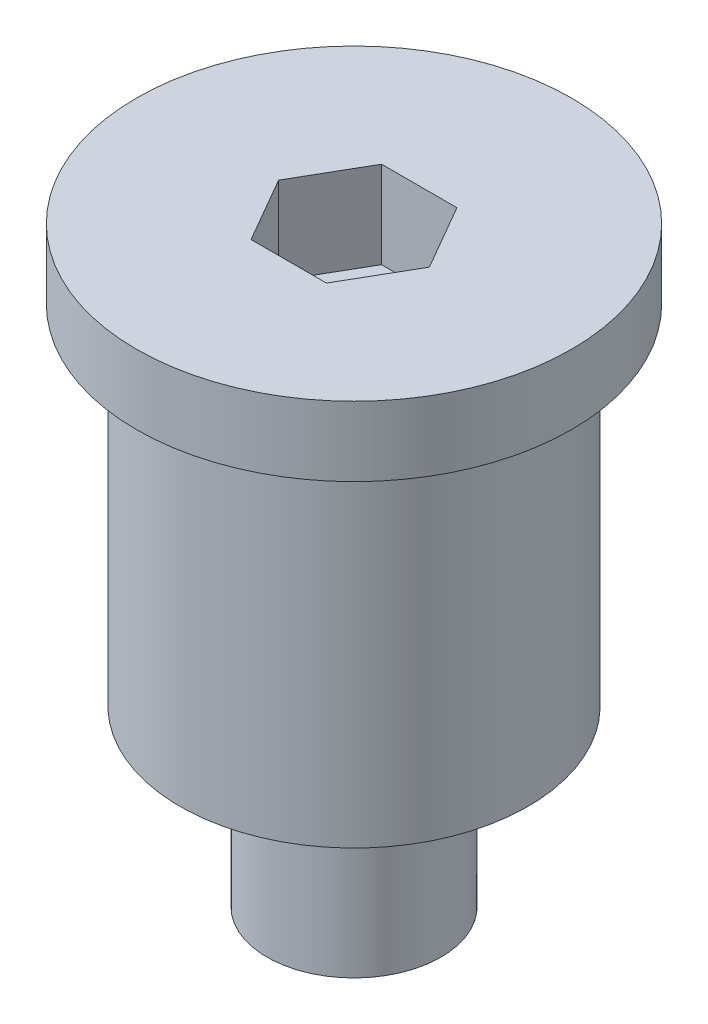
from build123d import *

# Parameters (mm, degrees)
CUT_EXTRUDE1_DEPTH = 3.175


with BuildPart() as part:
    # Sketch1 → Revolve1 (revolve)
    with BuildSketch(Plane(origin=(0, 0, 0), x_dir=(0, 0, -1), z_dir=(1, 0, 0)), mode=Mode.PRIVATE) as revolve1_sk:
        Polygon((0, 0), (0, 21.59), (-7.9375, 21.59), (-7.9375, 19.05), (-6.35, 19.05), (-6.35, 6.35), (-3.175, 6.35), (-3.175, 0), align=None)
    revolve(revolve1_sk.sketch.rotate(Axis((0, 0, 0), (0, 1, 0)), 180), axis=Axis((0, 0, 0), (0, 1, 0)))

    # Sketch2 → Cut-Extrude1 (cut)
    with BuildSketch(Plane(origin=(0, 21.59, 0), x_dir=(1, 0, 0), z_dir=(0, 1, 0))):
        Polygon((-1.374815329, 2.38125), (-2.749630657, 0), (-1.374815329, -2.38125), (1.374815329, -2.38125), (2.749630657, 0), (1.374815329, 2.38125), align=None)
    extrude(amount=-CUT_EXTRUDE1_DEPTH, mode=Mode.SUBTRACT)


solid = part.part
